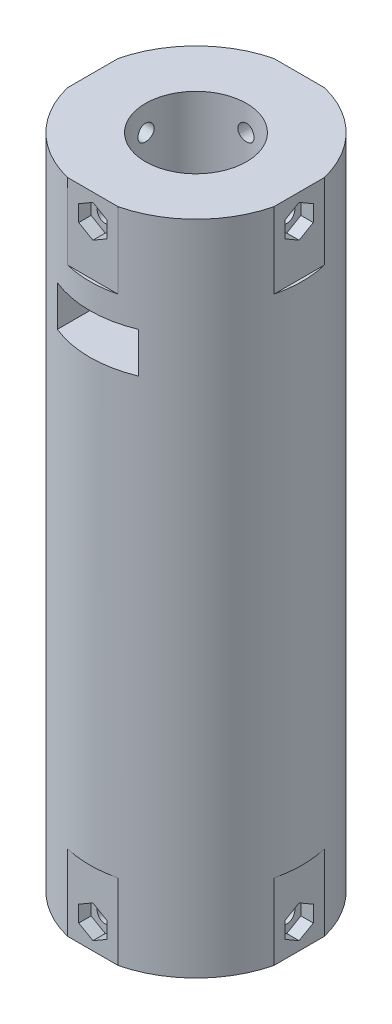
from build123d import *

# Parameters (mm, degrees)
SKETCH_1_R               = 21
SKETCH_1_R_2             = 10
EXTRUDE_1_DEPTH          = 45
SKETCH_4_R               = 21
SKETCH_4_R_2             = 10
EXTRUDE_2_DEPTH          = 85
CUT_EXTRUDE_3_DEPTH      = 15
CUT_EXTRUDE_START        = -15
CUT_EXTRUDE_4_DEPTH      = 15
CUT_EXTRUDE_6_DEPTH      = 25
CUT_EXTRUDE_START_2      = 20.4
CUT_EXTRUDE_7_DEPTH      = 2.45
PATTERN_CIRCULAR_1_COUNT = 4
SKETCH_14_R              = 1.6
CUT_EXTRUDE_8_DEPTH      = 22.45
PATTERN_CIRCULAR_2_COUNT = 4


with BuildPart() as part:
    # 草图1 → 凸台-拉伸1 (new body)
    with BuildSketch(Plane(origin=(0, 0, 0), x_dir=(1, 0, 0), z_dir=(0, 1, 0))):
        with Locations(Location((0, 0, 0), (0, 0, 90))):
            Circle(SKETCH_1_R)
        with Locations(Location((0, 0, 0), (0, 0, 90))):
            Circle(SKETCH_1_R_2, mode=Mode.SUBTRACT)
    extrude(amount=EXTRUDE_1_DEPTH)

    # 草图4 → 凸台-拉伸2 (add)
    with BuildSketch(Plane(origin=(0, 45, 0), x_dir=(1, 0, 0), z_dir=(0, 1, 0))):
        with Locations(Location((0, 0, 0), (0, 0, 90))):
            Circle(SKETCH_4_R)
        with Locations(Location((0, 0, 0), (0, 0, 90))):
            Circle(SKETCH_4_R_2, mode=Mode.SUBTRACT)
    extrude(amount=EXTRUDE_2_DEPTH)

    # 草图11 → 切除-拉伸3 (cut)
    with BuildSketch(Plane(origin=(0, 0, 0), x_dir=(1, 0, 0), z_dir=(0, 1, 0))):
        with BuildLine():
            Line((-20.396078054, 5), (-20.396078054, -5))
            ThreePointArc((-20.396078054, -5), (-21, 0), (-20.396078054, 5))
        make_face()
        with BuildLine():
            Line((-5, -20.396078054), (5, -20.396078054))
            ThreePointArc((5, -20.396078054), (0, -21), (-5, -20.396078054))
        make_face()
        with BuildLine():
            Line((20.396078054, -5), (20.396078054, 5))
            ThreePointArc((20.396078054, 5), (21, 0), (20.396078054, -5))
        make_face()
        with BuildLine():
            Line((5, 20.396078054), (-5, 20.396078054))
            ThreePointArc((-5, 20.396078054), (0, 21), (5, 20.396078054))
        make_face()
    extrude(amount=CUT_EXTRUDE_3_DEPTH, mode=Mode.SUBTRACT)

    # 草图5 → 切除-拉伸4 (cut)
    with BuildSketch(Plane(origin=(0, 130, 0), x_dir=(1, 0, 0), z_dir=(0, 1, 0)).offset(CUT_EXTRUDE_START)):
        with BuildLine():
            Line((-20.396078054, 5), (-20.396078054, -5))
            ThreePointArc((-20.396078054, -5), (-21, 0), (-20.396078054, 5))
        make_face()
        with BuildLine():
            Line((-5, -20.396078054), (5, -20.396078054))
            ThreePointArc((5, -20.396078054), (0, -21), (-5, -20.396078054))
        make_face()
        with BuildLine():
            Line((20.396078054, -5), (20.396078054, 5))
            ThreePointArc((20.396078054, 5), (21, 0), (20.396078054, -5))
        make_face()
        with BuildLine():
            Line((5, 20.396078054), (-5, 20.396078054))
            ThreePointArc((-5, 20.396078054), (0, 21), (5, 20.396078054))
        make_face()
    extrude(amount=CUT_EXTRUDE_4_DEPTH, mode=Mode.SUBTRACT)

    # 草图12 → 切除-拉伸6 (cut)
    with BuildSketch(Plane.XY):
        Polygon((0, 110), (8, 110), (8, 102), (-8, 102), (-8, 110), align=None)
    extrude(amount=CUT_EXTRUDE_6_DEPTH, mode=Mode.SUBTRACT)

    # 草图13 → 切除-拉伸7 (cut)
    with BuildSketch(Plane(origin=(0, 0, 0), x_dir=(0, 0, -1), z_dir=(1, 0, 0)).offset(CUT_EXTRUDE_START_2)):
        Polygon((0, 128.233161507), (-2.8, 126.616580754), (-2.8, 123.383419246), (0, 121.766838493), (2.8, 123.383419246), (2.8, 126.616580754), align=None)
        Polygon((0, 8.233161507), (-2.8, 6.616580754), (-2.8, 3.383419246), (0, 1.766838493), (2.8, 3.383419246), (2.8, 6.616580754), align=None)
    cut_extrude_7 = extrude(amount=-CUT_EXTRUDE_7_DEPTH, mode=Mode.SUBTRACT)

    # 阵列(圆周)1: 切除-拉伸7 ×4 about axis
    pattern_circular_1_axis = Axis((0, 0, 0), (0, 1, 0))
    for i in range(1, PATTERN_CIRCULAR_1_COUNT):
        add(cut_extrude_7.rotate(pattern_circular_1_axis, i * 360 / PATTERN_CIRCULAR_1_COUNT), mode=Mode.SUBTRACT)

    # 草图14 → 切除-拉伸8 (cut)
    with BuildSketch(Plane(origin=(0, 0, 0), x_dir=(0, 0, -1), z_dir=(1, 0, 0))):
        with Locations(Location((0, 125, 0), (0, 0, 180))):
            Circle(SKETCH_14_R)
        with Locations(Location((0, 5, 0), (0, 0, 180))):
            Circle(SKETCH_14_R)
    cut_extrude_8 = extrude(amount=CUT_EXTRUDE_8_DEPTH, mode=Mode.SUBTRACT)

    # 阵列(圆周)2: 切除-拉伸8 ×4 about axis
    pattern_circular_2_axis = Axis((0, 45, 0), (0, -1, 0))
    for i in range(1, PATTERN_CIRCULAR_2_COUNT):
        add(cut_extrude_8.rotate(pattern_circular_2_axis, i * 360 / PATTERN_CIRCULAR_2_COUNT), mode=Mode.SUBTRACT)


solid = part.part
